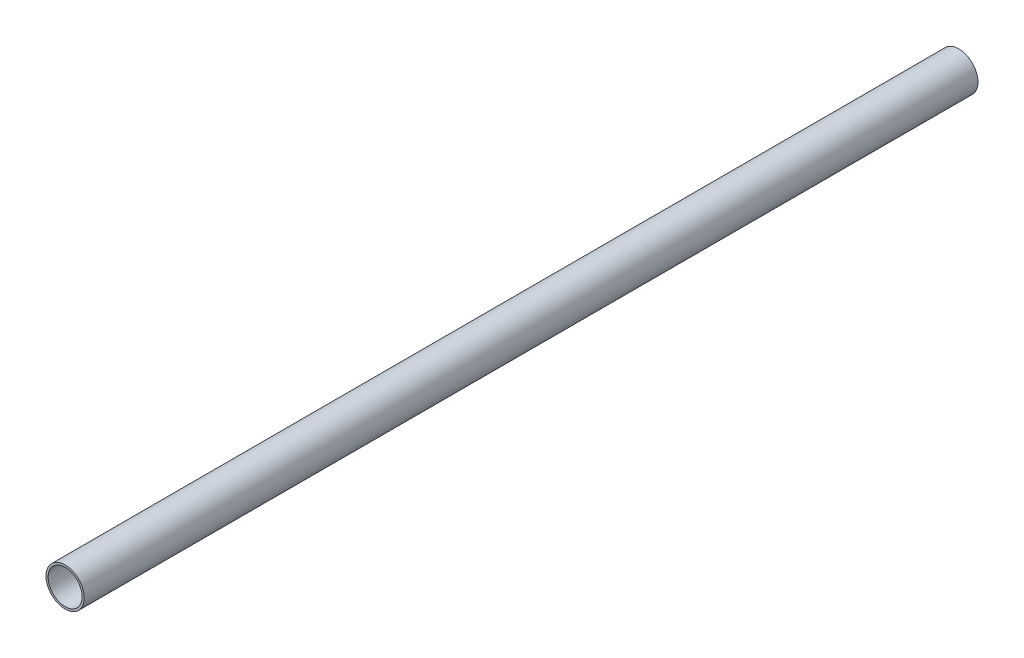
from build123d import *

# Parameters (mm, degrees)
SCHIZZO1_R                   = 9
SCHIZZO1_R_2                 = 8
ESTRUSIONE_ESTRUSIONE1_DEPTH = 420


with BuildPart() as part:
    # Schizzo1 → Estrusione-Estrusione1 (new body)
    with BuildSketch(Plane.XY):
        Circle(SCHIZZO1_R)
        Circle(SCHIZZO1_R_2, mode=Mode.SUBTRACT)
    extrude(amount=ESTRUSIONE_ESTRUSIONE1_DEPTH)


solid = part.part
